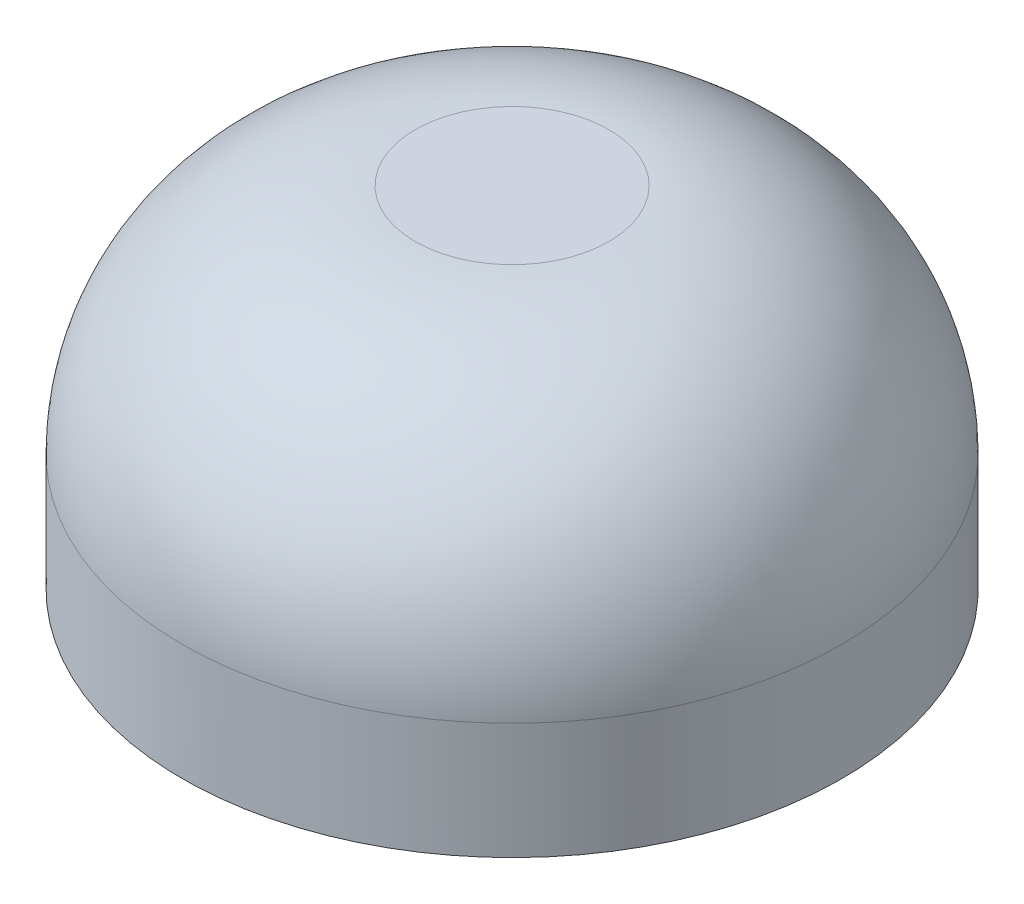
from build123d import *

# Parameters (mm, degrees)
SKETCH1_R           = 85
BOSS_EXTRUDE1_DEPTH = 90
FILLET1_R           = 60


with BuildPart() as part:
    # Sketch1 → Boss-Extrude1 (new body)
    with BuildSketch(Plane(origin=(0, 110, 0), x_dir=(1, 0, 0), z_dir=(0, 1, 0))):
        with Locations(Location((0, 0, 0), (0, 0, 90))):
            Circle(SKETCH1_R)
    extrude(amount=BOSS_EXTRUDE1_DEPTH)

    # Fillet1
    fillet1_edges = [part.edges().sort_by_distance(p)[0] for p in [
        (0, 200, 85),
    ]]
    fillet(fillet1_edges, radius=FILLET1_R)


solid = part.part
